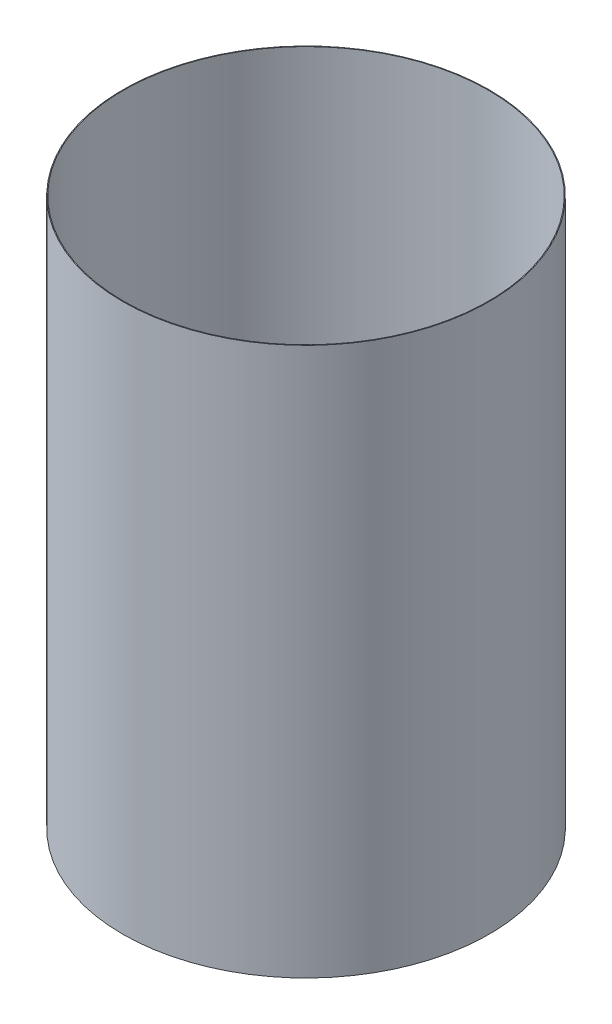
from build123d import *

# Parameters (mm, degrees)
SKETCH1_R           = 502
SKETCH1_R_2         = 500
BOSS_EXTRUDE1_DEPTH = 1500


with BuildPart() as part:
    # Sketch1 → Boss-Extrude1 (new body)
    with BuildSketch(Plane(origin=(0, 1800, 0), x_dir=(1, 0, 0), z_dir=(0, 1, 0))):
        with Locations(Location((0, 0, 0), (0, 0, 270))):
            Circle(SKETCH1_R)
        with Locations(Location((0, 0, 0), (0, 0, 270))):
            Circle(SKETCH1_R_2, mode=Mode.SUBTRACT)
    extrude(amount=BOSS_EXTRUDE1_DEPTH)


solid = part.part
